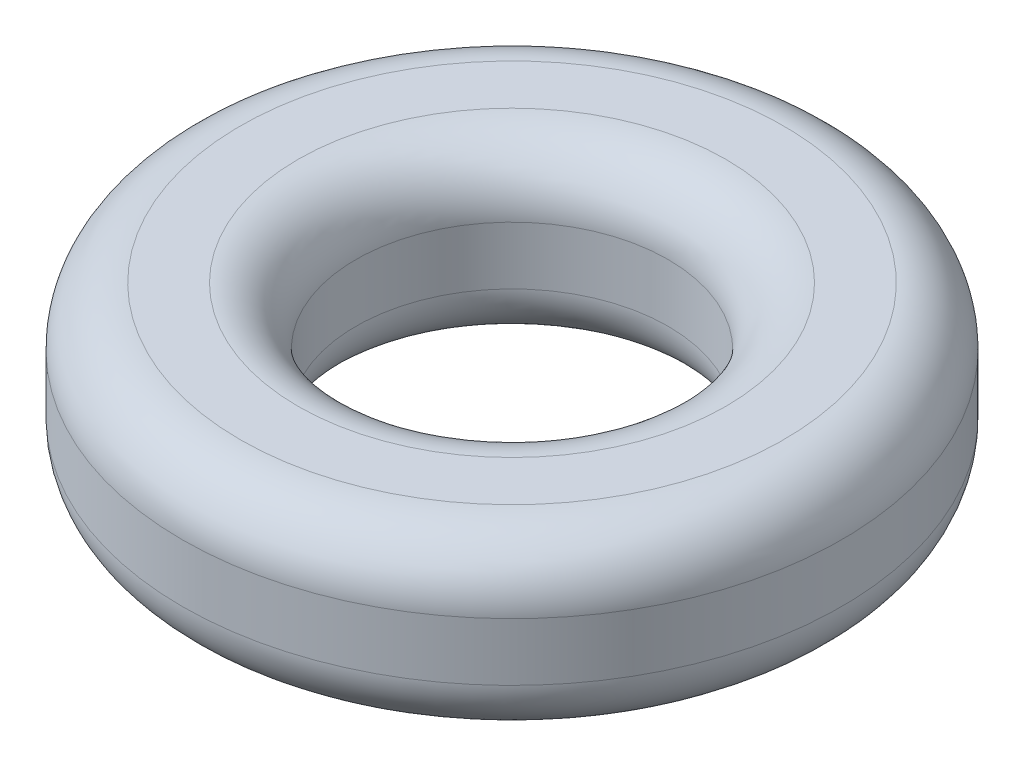
from build123d import *

# Parameters (mm, degrees)
SKETCH1_R           = 2.85
SKETCH1_R_2         = 1.35
BOSS_EXTRUDE1_DEPTH = 1.5
FILLET1_R           = 0.5


with BuildPart() as part:
    # Sketch1 → Boss-Extrude1 (new body)
    with BuildSketch(Plane(origin=(0, 0, 0), x_dir=(1, 0, 0), z_dir=(0, 1, 0))):
        with Locations(Location((0, 0, 0), (0, 0, 270))):
            Circle(SKETCH1_R)
        with Locations(Location((0, 0, 0), (0, 0, 270))):
            Circle(SKETCH1_R_2, mode=Mode.SUBTRACT)
    extrude(amount=BOSS_EXTRUDE1_DEPTH)

    # Fillet1
    fillet1_edges = [part.edges().sort_by_distance(p)[0] for p in [
        (0, 0, -2.85),
        (0, 1.5, -2.85),
        (0, 0, -1.35),
        (0, 1.5, -1.35),
    ]]
    fillet(fillet1_edges, radius=FILLET1_R)


solid = part.part
